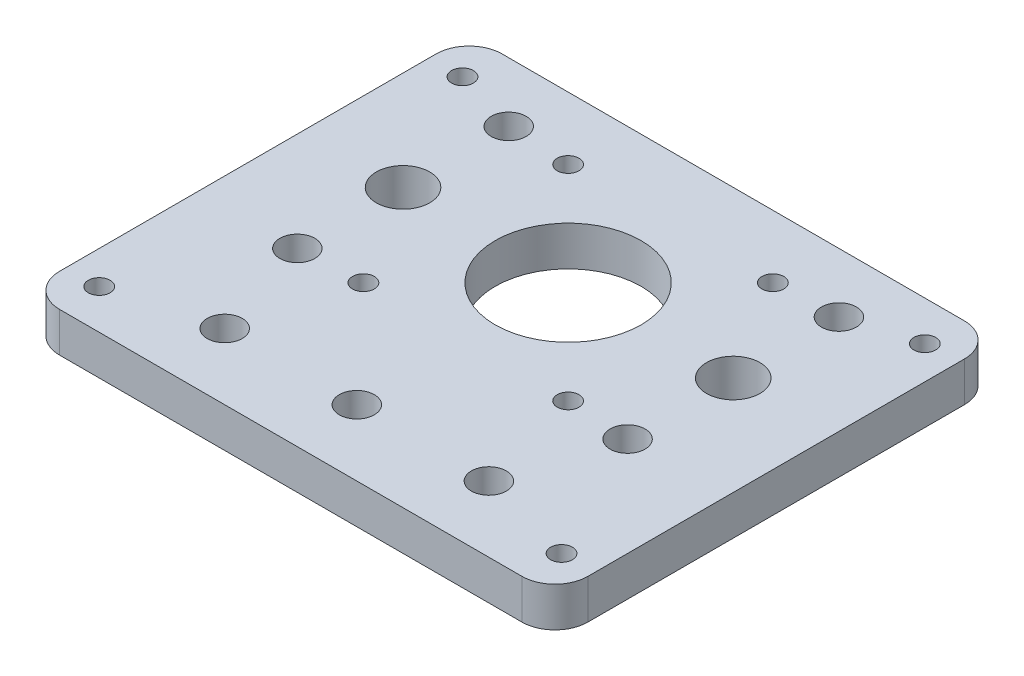
from build123d import *

# Parameters (mm, degrees)
SKETCH_1_R      = 11.05
SKETCH_1_R_2    = 1.65
SKETCH_1_R_3    = 4.05
SKETCH_1_R_4    = 2.65
EXTRUDE_1_DEPTH = 6


with BuildPart() as part:
    # 草图1 → 凸台-拉伸1 (new body)
    with BuildSketch(Plane(origin=(0, 0, 0), x_dir=(1, 0, 0), z_dir=(0, 1, 0))):
        with BuildLine():
            Line((-35, -42), (35, -42))
            ThreePointArc((35, -42), (38.535533906, -40.535533906), (40, -37))
            Line((40, -37), (40, 20))
            ThreePointArc((40, 20), (38.535533906, 23.535533906), (35, 25))
            Line((35, 25), (-35, 25))
            ThreePointArc((-35, 25), (-38.535533906, 23.535533906), (-40, 20))
            Line((-40, 20), (-40, -37))
            ThreePointArc((-40, -37), (-38.535533906, -40.535533906), (-35, -42))
        make_face()
        with Locations(Location((0, 0, 0), (0, 0, 270))):
            Circle(SKETCH_1_R, mode=Mode.SUBTRACT)
        with Locations(Location((-15.5, 15.5, 0), (0, 0, 270))):
            Circle(SKETCH_1_R_2, mode=Mode.SUBTRACT)
        with Locations(Location((15.5, 15.5, 0), (0, 0, 270))):
            Circle(SKETCH_1_R_2, mode=Mode.SUBTRACT)
        with Locations(Location((15.5, -15.5, 0), (0, 0, 270))):
            Circle(SKETCH_1_R_2, mode=Mode.SUBTRACT)
        with Locations(Location((-15.5, -15.5, 0), (0, 0, 270))):
            Circle(SKETCH_1_R_2, mode=Mode.SUBTRACT)
        with Locations(Location((-25, 0, 0), (0, 0, 270))):
            Circle(SKETCH_1_R_3, mode=Mode.SUBTRACT)
        with Locations(Location((-25, 16, 0), (0, 0, 270))):
            Circle(SKETCH_1_R_4, mode=Mode.SUBTRACT)
        with Locations(Location((-25, -16, 0), (0, 0, 90))):
            Circle(SKETCH_1_R_4, mode=Mode.SUBTRACT)
        with Locations(Location((25, 0, 0), (0, 0, 90))):
            Circle(SKETCH_1_R_3, mode=Mode.SUBTRACT)
        with Locations(Location((25, -16, 0), (0, 0, 270))):
            Circle(SKETCH_1_R_4, mode=Mode.SUBTRACT)
        with Locations(Location((25, 16, 0), (0, 0, 90))):
            Circle(SKETCH_1_R_4, mode=Mode.SUBTRACT)
        with Locations(Location((-20, -32, 0), (0, 0, 270))):
            Circle(SKETCH_1_R_4, mode=Mode.SUBTRACT)
        with Locations(Location((0, -32, 0), (0, 0, 270))):
            Circle(SKETCH_1_R_4, mode=Mode.SUBTRACT)
        with Locations(Location((20, -32, 0), (0, 0, 270))):
            Circle(SKETCH_1_R_4, mode=Mode.SUBTRACT)
        with Locations(Location((-35, 19, 0), (0, 0, 270))):
            Circle(SKETCH_1_R_2, mode=Mode.SUBTRACT)
        with Locations(Location((-35, -36, 0), (0, 0, 270))):
            Circle(SKETCH_1_R_2, mode=Mode.SUBTRACT)
        with Locations(Location((35, -36, 0), (0, 0, 90))):
            Circle(SKETCH_1_R_2, mode=Mode.SUBTRACT)
        with Locations(Location((35, 19, 0), (0, 0, 90))):
            Circle(SKETCH_1_R_2, mode=Mode.SUBTRACT)
    extrude(amount=EXTRUDE_1_DEPTH)


solid = part.part
